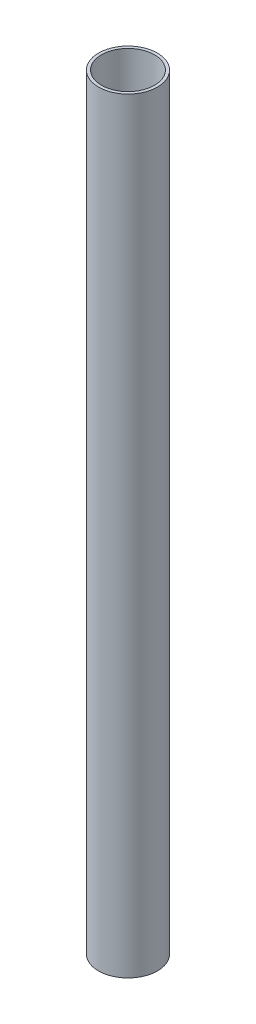
from build123d import *

# Parameters (mm, degrees)
SKETCH_1_R   = 10
SKETCH_1_R_2 = 9
F_1MM_DEPTH  = 130


with BuildPart() as part:
    # 草图1 → 1mm (new, symmetric)
    with BuildSketch(Plane(origin=(0, 0, 0), x_dir=(1, 0, 0), z_dir=(0, 1, 0))):
        Circle(SKETCH_1_R)
        Circle(SKETCH_1_R_2, mode=Mode.SUBTRACT)
    extrude(amount=F_1MM_DEPTH, both=True)


solid = part.part
